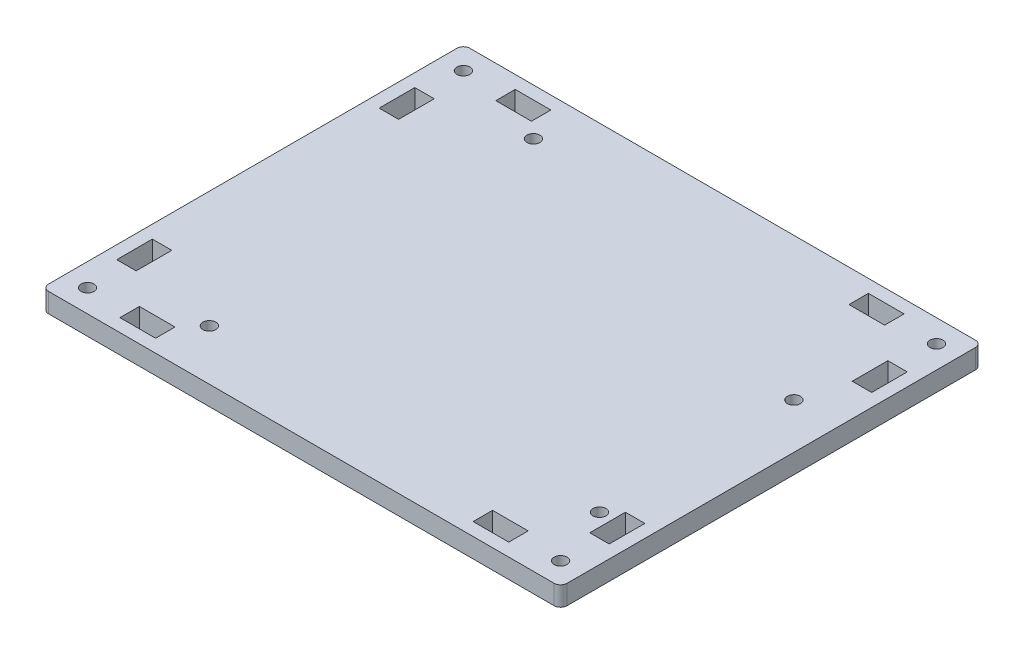
from build123d import *

# Parameters (mm, degrees)
CROQUIS1_R              = 1
CROQUIS1_W              = 3
CROQUIS1_H              = 5.5
CROQUIS1_W_2            = 5.5
CROQUIS1_H_2            = 3
SALIENTE_EXTRUIR1_DEPTH = 3


with BuildPart() as part:
    # Croquis1 → Saliente-Extruir1 (new body)
    with BuildSketch(Plane(origin=(0, 0, 0), x_dir=(1, 0, 0), z_dir=(0, 1, 0))):
        with BuildLine():
            Line((-39, -32.5), (39, -32.5))
            ThreePointArc((39, -32.5), (39.707106781, -32.207106781), (40, -31.5))
            Line((40, -31.5), (40, 31.5))
            ThreePointArc((40, 31.5), (39.707106781, 32.207106781), (39, 32.5))
            Line((39, 32.5), (-39, 32.5))
            ThreePointArc((-39, 32.5), (-39.707106781, 32.207106781), (-40, 31.5))
            Line((-40, 31.5), (-40, -31.5))
            ThreePointArc((-40, -31.5), (-39.707106781, -32.207106781), (-39, -32.5))
        make_face()
        with Locations(Location((-36.5, 29, 0), (0, 0, 270))):
            Circle(CROQUIS1_R, mode=Mode.SUBTRACT)
        with Locations(Location((-36.5, -29, 0), (0, 0, 270))):
            Circle(CROQUIS1_R, mode=Mode.SUBTRACT)
        with Locations(Location((36.5, -29, 0), (0, 0, 90))):
            Circle(CROQUIS1_R, mode=Mode.SUBTRACT)
        with Locations(Location((36.5, 29, 0), (0, 0, 90))):
            Circle(CROQUIS1_R, mode=Mode.SUBTRACT)
        with Locations(Location((-22, 25.3, 0), (0, 0, 270))):
            Circle(CROQUIS1_R, mode=Mode.SUBTRACT)
        with Locations(Location((-22, -24.7, 0), (0, 0, 270))):
            Circle(CROQUIS1_R, mode=Mode.SUBTRACT)
        with Locations(Location((33, 10.5, 0), (0, 0, 270))):
            Circle(CROQUIS1_R, mode=Mode.SUBTRACT)
        with Locations(Location((33, -19.5, 0), (0, 0, 270))):
            Circle(CROQUIS1_R, mode=Mode.SUBTRACT)
        with Locations((-36.5, 20.25)):
            Rectangle(CROQUIS1_W, CROQUIS1_H, mode=Mode.SUBTRACT)
        with Locations((-36.5, -20.25)):
            Rectangle(CROQUIS1_W, CROQUIS1_H, mode=Mode.SUBTRACT)
        with Locations((-27.25, 29)):
            Rectangle(CROQUIS1_W_2, CROQUIS1_H_2, mode=Mode.SUBTRACT)
        with Locations((-27.25, -29)):
            Rectangle(CROQUIS1_W_2, CROQUIS1_H_2, mode=Mode.SUBTRACT)
        with Locations((27.25, -29)):
            Rectangle(CROQUIS1_W_2, CROQUIS1_H_2, mode=Mode.SUBTRACT)
        with Locations((36.5, -20.25)):
            Rectangle(CROQUIS1_W, CROQUIS1_H, mode=Mode.SUBTRACT)
        with Locations((36.5, 20.25)):
            Rectangle(CROQUIS1_W, CROQUIS1_H, mode=Mode.SUBTRACT)
        with Locations((27.25, 29)):
            Rectangle(CROQUIS1_W_2, CROQUIS1_H_2, mode=Mode.SUBTRACT)
    extrude(amount=SALIENTE_EXTRUIR1_DEPTH)


solid = part.part
